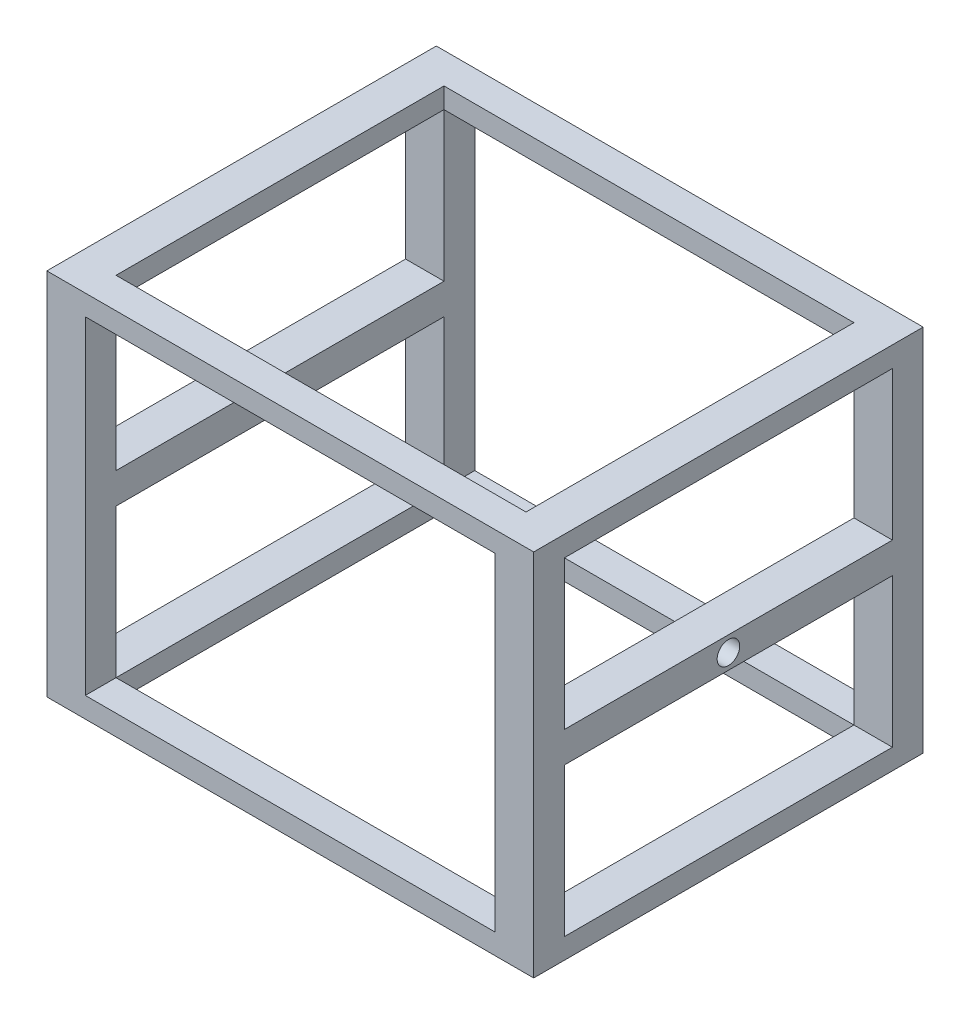
from build123d import *

# Parameters (mm, degrees)
SKETCH1_W               = 1187.5
SKETCH1_H               = 950
SKETCH1_W_2             = 1000
SKETCH1_H_2             = 800
BOSS_EXTRUDE1_DEPTH     = 50
SKETCH2_W               = 93.75
SKETCH2_H               = 75
BOSS_EXTRUDE2_DEPTH     = 800
SKETCH3_W               = 950
SKETCH3_H               = 75
BOSS_EXTRUDE3_DEPTH     = 93.75
SKETCH4_W               = 950
SKETCH4_H               = 75
BOSS_EXTRUDE4_DEPTH     = 93.75
CUT_EXTRUDE1_DEPTH      = 2000
CUT_EXTRUDE1_DEPTH_BACK = 2000
SKETCH5_R               = 27.5


with BuildPart() as part:
    # Sketch1 → Boss-Extrude1 (new body)
    with BuildSketch(Plane(origin=(0, 0, 0), x_dir=(1, 0, 0), z_dir=(0, 1, 0))):
        Rectangle(SKETCH1_W, SKETCH1_H)
        Rectangle(SKETCH1_W_2, SKETCH1_H_2, mode=Mode.SUBTRACT)
    boss_extrude1 = extrude(amount=BOSS_EXTRUDE1_DEPTH)

    # Sketch2 → Boss-Extrude2 (add)
    with BuildSketch(Plane(origin=(0, 50, 0), x_dir=(1, 0, 0), z_dir=(0, 1, 0))):
        with Locations((-546.875, 437.5)):
            Rectangle(SKETCH2_W, SKETCH2_H)
        with Locations((-546.875, -437.5)):
            Rectangle(SKETCH2_W, SKETCH2_H)
        with Locations((546.875, 437.5)):
            Rectangle(SKETCH2_W, SKETCH2_H)
        with Locations((546.875, -437.5)):
            Rectangle(SKETCH2_W, SKETCH2_H)
    extrude(amount=BOSS_EXTRUDE2_DEPTH)

    # Mirror1: Boss-Extrude1 across plane
    add(boss_extrude1.mirror(Plane.ZX.offset(450)))

    # Sketch3 → Boss-Extrude3 (add)
    with BuildSketch(Plane(origin=(593.75, 0, 0), x_dir=(0, 0, -1), z_dir=(1, 0, 0))):
        with Locations((0, 450)):
            Rectangle(SKETCH3_W, SKETCH3_H)
    extrude(amount=-BOSS_EXTRUDE3_DEPTH)

    # Sketch4 → Boss-Extrude4 (add)
    with BuildSketch(Plane.ZY.offset(593.75)):
        with Locations((0, 450)):
            Rectangle(SKETCH4_W, SKETCH4_H)
    extrude(amount=-BOSS_EXTRUDE4_DEPTH)

    # Sketch5 → Cut-Extrude1 (cut, two sides: drawn at the far end of the back side and taken through both)
    with BuildSketch(Plane(origin=(593.75, 0, 0), x_dir=(0, 0, -1), z_dir=(1, 0, 0)).offset(-CUT_EXTRUDE1_DEPTH_BACK)):
        with Locations(Location((0, 450, 0), (0, 0, 180))):
            Circle(SKETCH5_R)
    extrude(amount=CUT_EXTRUDE1_DEPTH + CUT_EXTRUDE1_DEPTH_BACK, mode=Mode.SUBTRACT)


solid = part.part
